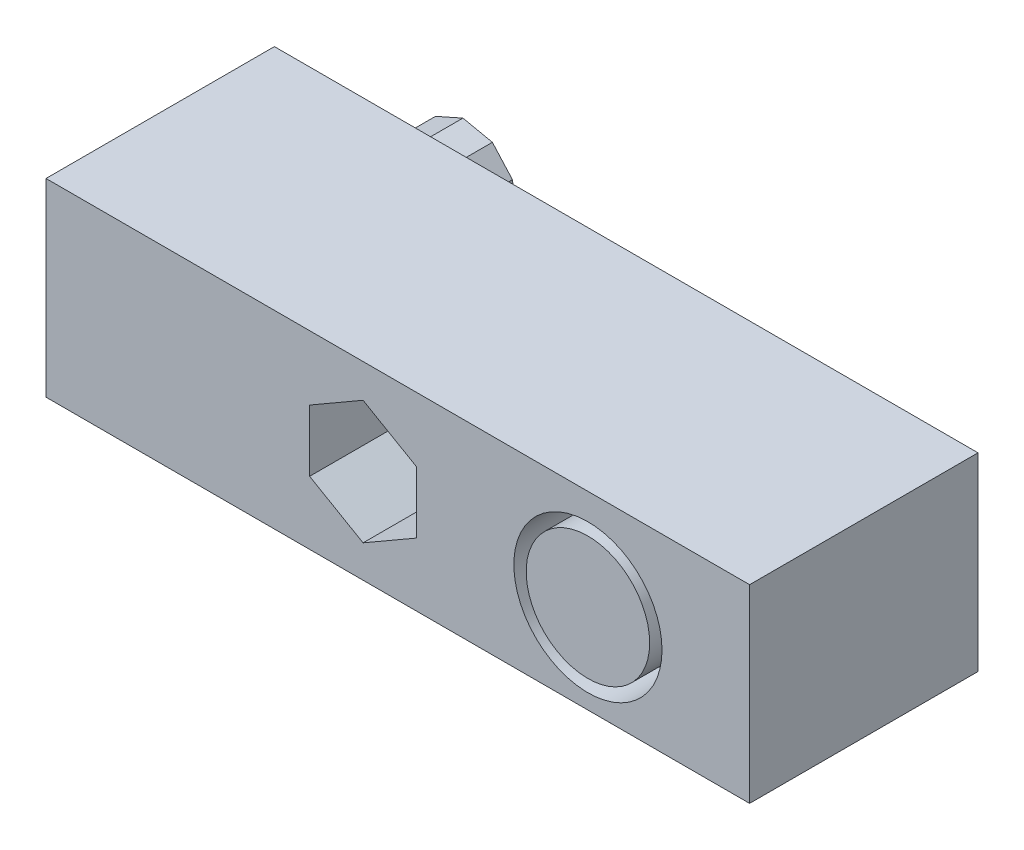
from build123d import *

# Parameters (mm, degrees)
SKETCH1_W           = 113.977664974
SKETCH1_H           = 30.686294416
BOSS_EXTRUDE1_DEPTH = 37
CUT_EXTRUDE1_DEPTH  = 37
SKETCH3_R           = 12
SKETCH3_R_2         = 9.999590175
CUT_EXTRUDE2_DEPTH  = 37
BOSS_EXTRUDE2_DEPTH = 10


with BuildPart() as part:
    # Sketch1 → Boss-Extrude1 (new body)
    with BuildSketch(Plane.XY):
        with Locations((5.623994078, -2.739847716)):
            Rectangle(SKETCH1_W, SKETCH1_H)
    extrude(amount=BOSS_EXTRUDE1_DEPTH)

    # Sketch2 → Cut-Extrude1 (cut)
    with BuildSketch(Plane.XY.offset(37)):
        Polygon((-8.660254038, -7.832783782), (0, -12.832783782), (8.660254038, -7.832783782), (8.660254038, 2.167216218), (0, 7.167216218), (-8.660254038, 2.167216218), align=None)
    extrude(amount=-CUT_EXTRUDE1_DEPTH, mode=Mode.SUBTRACT)

    # Sketch3 → Cut-Extrude2 (cut)
    with BuildSketch(Plane.XY.offset(37)):
        with Locations((36.425340455, -3.657904006)):
            Circle(SKETCH3_R)
        with Locations((36.425340455, -3.657904006)):
            Circle(SKETCH3_R_2, mode=Mode.SUBTRACT)
    extrude(amount=-CUT_EXTRUDE2_DEPTH, mode=Mode.SUBTRACT)


with BuildPart() as cut_extrude2_piece_1:
    # of the separate pieces the step leaves, piece 1, a body of its own (cut_extrude2_pieces)
    add(part.part.solids().sort_by_distance((-51.364838409, 12.603299492, 0))[0])

    # Sketch4 → Boss-Extrude2 (add)
    with BuildSketch(Plane(origin=(0, 0, 0), x_dir=(-1, 0, 0), z_dir=(0, 0, -1))):
        Polygon((22.795810959, 3.207511616), (22.286360611, -1.639584667), (24.723258332, -5.860415333), (29.175692021, -7.842766531), (33.942983341, -6.82944748), (37.204189041, -3.207511616), (37.713639389, 1.639584667), (35.276741668, 5.860415333), (30.824307979, 7.842766531), (26.057016659, 6.82944748), align=None)
        Polygon((24.366696231, 3.357385239), (24.275767209, -3.199891552), (29.909070977, -6.55727679), (35.633303769, -3.357385239), (35.724232791, 3.199891552), (30.090929023, 6.55727679), align=None, mode=Mode.SUBTRACT)
    extrude(amount=BOSS_EXTRUDE2_DEPTH)


with BuildPart() as cut_extrude2_piece_2:
    # of the separate pieces the step leaves, piece 2, a body of its own (cut_extrude2_pieces)
    add(part.part.solids().sort_by_distance((46.42493063, -3.657904006, 0))[0])


solid = Compound([cut_extrude2_piece_1.part, cut_extrude2_piece_2.part])
